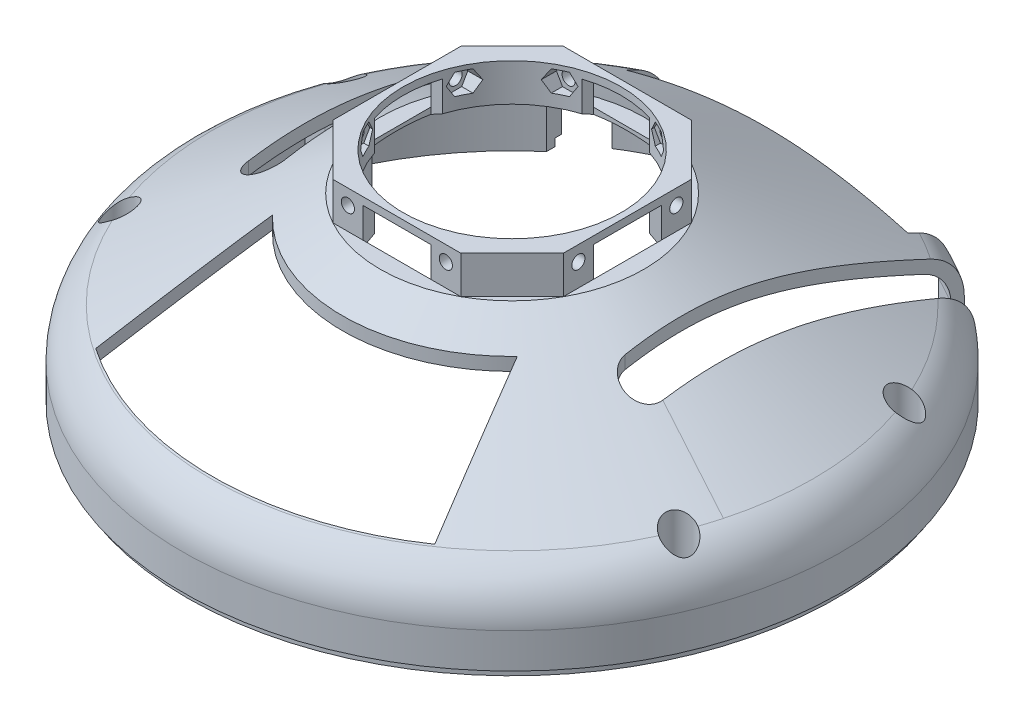
from build123d import *

# Parameters (mm, degrees)
SHELL2_T                                   = -3
SKETCH4_W                                  = 75
SKETCH4_H                                  = 40
CUT_EXTRUDE2_DEPTH                         = 134.463478216
SKETCH5_R                                  = 86
CUT_EXTRUDE3_DEPTH                         = 2
BOSS_EXTRUDE1_REACH                        = 135.463
SKETCH7_R                                  = 1.75
SKETCH8_R                                  = 4
CUT_EXTRUDE4_DEPTH                         = 43
MIRROR1_AT_THE_SECOND_PLANE_COPY_1_REACH   = 135.463
MIRROR1_AT_THE_SECOND_PLANE_COPY_1_SKETC_R = 1.75
MIRROR1_AT_THE_SECOND_PLANE_COPY_2_SKETC_R = 4
MIRROR1_AT_THE_SECOND_PLANE_COPY_2_DEPTH   = 43
CUT_EXTRUDE5_DEPTH                         = 134.463478319
CUT_EXTRUDE6_DEPTH                         = 134.463478319
SKETCH11_R                                 = 28.953306689
BOSS_EXTRUDE2_DEPTH                        = 10
SKETCH13_R                                 = 1.75
SKETCH13_W                                 = 18
SKETCH13_H                                 = 10
CUT_EXTRUDE7_DEPTH                         = 10
CUT_EXTRUDE8_DEPTH                         = 28
CIRPATTERN1_COUNT                          = 4
BOSS_EXTRUDE3_DEPTH                        = 2
CUT_EXTRUDE9_START                         = -2
CUT_EXTRUDE9_DEPTH                         = 2


with BuildPart() as part:
    # Sketch1 → Revolve1 (revolve)
    with BuildSketch(Plane.XY):
        with BuildLine():
            Line((0, 0), (-87.5, 0))
            Line((-87.5, 0), (-87.5, 11.295161968))
            ThreePointArc((-87.5, 11.295161968), (-85.473651397, 18.824064241), (-79.942084075, 24.3188091))
            Line((-79.942084075, 24.3188091), (-35, 50))
            Line((-35, 50), (0, 50))
            Line((0, 50), (0, 0))
        make_face()
    revolve(axis=Axis((0, 50, 0), (0, -1, 0)))

    # Shell2
    shell2_openings = [part.faces().sort_by_distance(p)[0] for p in [
        (0, 50, 0),
        (0, 0, 0),
    ]]
    offset(amount=SHELL2_T, openings=shell2_openings, kind=Kind.INTERSECTION)

    # Sketch4 → Cut-Extrude2 (cut, through all)
    with BuildSketch(Plane(origin=(0, 0, 0), x_dir=(1, 0, 0), z_dir=(0, 1, 0))):
        with Locations((0, 87.5)):
            Rectangle(SKETCH4_W, SKETCH4_H)
    extrude(amount=CUT_EXTRUDE2_DEPTH, mode=Mode.SUBTRACT)

    # Sketch5 → Cut-Extrude3 (cut)
    with BuildSketch(Plane.XZ):
        Circle(SKETCH5_R)
    extrude(amount=-CUT_EXTRUDE3_DEPTH, mode=Mode.SUBTRACT)

    # Sketch7 → Boss-Extrude1 (add, up to next)
    with BuildSketch(Plane.XZ, mode=Mode.PRIVATE) as boss_extrude1_sk1:
        with BuildLine():
            Line((-71.045427909, 33.86822026), (-75.679952978, 37.587161601))
            ThreePointArc((-75.679952978, 37.587161601), (-78.347035711, 31.654257144), (-80.549838693, 25.533771491))
            Line((-80.549838693, 25.533771491), (-74.632646623, 24.989542381))
            ThreePointArc((-74.632646623, 24.989542381), (-69.538789093, 28.095494506), (-71.045427909, 33.86822026))
        make_face()
        with Locations((-74.174708365, 29.968527473)):
            Circle(SKETCH7_R, mode=Mode.SUBTRACT)
    boss_extrude1_tool1 = extrude(boss_extrude1_sk1.sketch, amount=-BOSS_EXTRUDE1_REACH, mode=Mode.PRIVATE) - part.part
    boss_extrude1 = boss_extrude1_tool1.solids().sort_by_distance((-77.575683, 0, 25.430832))[0]
    add(boss_extrude1)

    # Sketch8 → Cut-Extrude4 (cut)
    with BuildSketch(Plane(origin=(0, 50, 0), x_dir=(1, 0, 0), z_dir=(0, 1, 0))):
        with Locations(Location((-74.174708365, -29.968527473, 0), (0, 0, 180))):
            Circle(SKETCH8_R)
    cut_extrude4 = extrude(amount=-CUT_EXTRUDE4_DEPTH, mode=Mode.SUBTRACT)

    # Mirror1: Boss-Extrude1, Cut-Extrude4 across plane
    add(boss_extrude1.mirror(Plane(origin=(0, 0, 0), x_dir=(0, 0, 1), z_dir=(1, 0, 0))))
    add(cut_extrude4.mirror(Plane(origin=(0, 0, 0), x_dir=(0, 0, 1), z_dir=(1, 0, 0))), mode=Mode.SUBTRACT)

    # Mirror1 at the second plane: Boss-Extrude1, Cut-Extrude4 across plane
    add(boss_extrude1.mirror(Plane.XY))
    add(cut_extrude4.mirror(Plane.XY), mode=Mode.SUBTRACT)

    # Mirror1 at the second plane copy 1 sketc → Mirror1 at the second plane copy 1 (add, up to next)
    with BuildSketch(Plane(origin=(0, 0, 0), x_dir=(-1, 0, 0), z_dir=(0, -1, 0)), mode=Mode.PRIVATE) as mirror1_at_the_second_plane_copy_1_sk1:
        with BuildLine():
            Line((-71.045427909, 33.86822026), (-75.679952978, 37.587161601))
            ThreePointArc((-75.679952978, 37.587161601), (-78.347035711, 31.654257144), (-80.549838693, 25.533771491))
            Line((-80.549838693, 25.533771491), (-74.632646623, 24.989542381))
            ThreePointArc((-74.632646623, 24.989542381), (-69.538789093, 28.095494506), (-71.045427909, 33.86822026))
        make_face()
        with Locations((-74.174708365, 29.968527473)):
            Circle(MIRROR1_AT_THE_SECOND_PLANE_COPY_1_SKETC_R, mode=Mode.SUBTRACT)
    mirror1_at_the_second_plane_copy_1_tool1 = extrude(mirror1_at_the_second_plane_copy_1_sk1.sketch, amount=-MIRROR1_AT_THE_SECOND_PLANE_COPY_1_REACH, mode=Mode.PRIVATE) - part.part
    add(mirror1_at_the_second_plane_copy_1_tool1.solids().sort_by_distance((77.575683, 0, -25.430832))[0])

    # Mirror1 at the second plane copy 2 sketc → Mirror1 at the second plane copy 2 (cut)
    with BuildSketch(Plane(origin=(0, 50, 0), x_dir=(-1, 0, 0), z_dir=(0, 1, 0))):
        with Locations(Location((-74.174708365, -29.968527473, 0), (0, 0, 180))):
            Circle(MIRROR1_AT_THE_SECOND_PLANE_COPY_2_SKETC_R)
    extrude(amount=-MIRROR1_AT_THE_SECOND_PLANE_COPY_2_DEPTH, mode=Mode.SUBTRACT)

    # Sketch9 → Cut-Extrude5 (cut, through all)
    with BuildSketch(Plane(origin=(0, 0, 0), x_dir=(1, 0, 0), z_dir=(0, 1, 0))):
        with BuildLine():
            Line((-45, 82.5), (-45, -15))
            ThreePointArc((-45, -15), (-50, -20), (-55, -15))
            Line((-55, -15), (-55, 82.5))
            ThreePointArc((-55, 82.5), (-50, 87.5), (-45, 82.5))
        make_face()
        with BuildLine():
            Line((45, -15), (45, 82.5))
            ThreePointArc((45, 82.5), (50, 87.5), (55, 82.5))
            Line((55, 82.5), (55, -15))
            ThreePointArc((55, -15), (50, -20), (45, -15))
        make_face()
    extrude(amount=CUT_EXTRUDE5_DEPTH, mode=Mode.SUBTRACT)

    # Sketch10 → Cut-Extrude6 (cut, through all)
    with BuildSketch(Plane(origin=(0, 0, 0), x_dir=(1, 0, 0), z_dir=(0, 1, 0))):
        with BuildLine():
            Line((-32.5, -31.124748995), (-45, -65.538156825))
            ThreePointArc((-45, -65.538156825), (0, -79.5), (45, -65.538156825))
            Line((45, -65.538156825), (32.5, -31.124748995))
            ThreePointArc((32.5, -31.124748995), (0, -45), (-32.5, -31.124748995))
        make_face()
    extrude(amount=CUT_EXTRUDE6_DEPTH, mode=Mode.SUBTRACT)

    # Sketch11 → Boss-Extrude2 (add)
    with BuildSketch(Plane(origin=(0, 50, 0), x_dir=(1, 0, 0), z_dir=(0, 1, 0))):
        Polygon((-17, 30.594117082), (-30.594117082, 17), (-30.594117082, -17), (-17, -30.594117082), (17, -30.594117082), (30.594117082, -17), (30.594117082, 17), (17, 30.594117082), align=None)
        with Locations(Location((0, 0, 0), (0, 0, 341.889818981))):
            Circle(SKETCH11_R, mode=Mode.SUBTRACT)
    extrude(amount=BOSS_EXTRUDE2_DEPTH)

    # Sketch13 → Cut-Extrude7 (cut)
    with BuildSketch(Plane.XY.offset(30.594117082)):
        with Locations((-13, 56)):
            Circle(SKETCH13_R)
        with Locations((13, 56)):
            Circle(SKETCH13_R)
        with Locations((0, 53)):
            Rectangle(SKETCH13_W, SKETCH13_H)
    cut_extrude7 = extrude(amount=-CUT_EXTRUDE7_DEPTH, mode=Mode.SUBTRACT)

    # Sketch14 → Cut-Extrude8 (cut)
    with BuildSketch(Plane.XY):
        Polygon((-9.766838493, 56), (-11.383419246, 58.8), (-14.616580754, 58.8), (-16.233161507, 56), (-14.616580754, 53.2), (-11.383419246, 53.2), align=None)
        Polygon((16.233161507, 56), (14.616580754, 58.8), (11.383419246, 58.8), (9.766838493, 56), (11.383419246, 53.2), (14.616580754, 53.2), align=None)
    cut_extrude8 = extrude(amount=CUT_EXTRUDE8_DEPTH, mode=Mode.SUBTRACT)

    # CirPattern1: Cut-Extrude7, Cut-Extrude8 ×4 about axis
    cirpattern1_axis = Axis((0, 0, 0), (0, 1, 0))
    add([cut_extrude7.rotate(cirpattern1_axis, i * 360 / CIRPATTERN1_COUNT) for i in range(1, CIRPATTERN1_COUNT)], mode=Mode.SUBTRACT)
    add([cut_extrude8.rotate(cirpattern1_axis, i * 360 / CIRPATTERN1_COUNT) for i in range(1, CIRPATTERN1_COUNT)], mode=Mode.SUBTRACT)

    # Sketch15 → Boss-Extrude3 (add)
    with BuildSketch(Plane.XZ.offset(-2)):
        with BuildLine():
            Line((-55, -66.113538704), (-55, -64.150214341))
            ThreePointArc((-55, -64.150214341), (-66.676168684, -51.908944602), (-75.679952978, -37.587161601))
            ThreePointArc((-75.679952978, -37.587161601), (-78.347035711, -31.654257144), (-80.549838693, -25.533771491))
            ThreePointArc((-80.549838693, -25.533771491), (-84.5, 0), (-80.549838693, 25.533771491))
            ThreePointArc((-80.549838693, 25.533771491), (-78.347035711, 31.654257144), (-75.679952978, 37.587161601))
            ThreePointArc((-75.679952978, 37.587161601), (0, 84.5), (75.679952978, 37.587161601))
            ThreePointArc((75.679952978, 37.587161601), (78.347035711, 31.654257144), (80.549838693, 25.533771491))
            ThreePointArc((80.549838693, 25.533771491), (84.5, 0), (80.549838693, -25.533771491))
            ThreePointArc((80.549838693, -25.533771491), (78.347035711, -31.654257144), (75.679952978, -37.587161601))
            ThreePointArc((75.679952978, -37.587161601), (66.676168684, -51.908944602), (55, -64.150214341))
            Line((55, -64.150214341), (55, -66.113538704))
            ThreePointArc((55, -66.113538704), (0, 86), (-55, -66.113538704))
        make_face()
        with BuildLine():
            Line((45, -73.287106642), (45, -71.520975944))
            ThreePointArc((45, -71.520975944), (41.303476002, -73.717520781), (37.5, -75.723180071))
            Line((37.5, -75.723180071), (37.5, -77.393475177))
            ThreePointArc((37.5, -77.393475177), (41.301066156, -75.433559735), (45, -73.287106642))
        make_face()
        with BuildLine():
            Line((-45, -71.520975944), (-45, -73.287106642))
            ThreePointArc((-45, -73.287106642), (-41.301066156, -75.433559735), (-37.5, -77.393475177))
            Line((-37.5, -77.393475177), (-37.5, -75.723180071))
            ThreePointArc((-37.5, -75.723180071), (-41.303476002, -73.717520781), (-45, -71.520975944))
        make_face()
    extrude(amount=BOSS_EXTRUDE3_DEPTH)

    # Sketch16 → Cut-Extrude9 (cut)
    with BuildSketch(Plane.XZ.offset(CUT_EXTRUDE9_START)):
        with BuildLine():
            Line((-55, -68.053287944), (-55, -66.373488683))
            ThreePointArc((-55, -66.373488683), (0, 86.2), (55, -66.373488683))
            Line((55, -66.373488683), (55, -68.053287944))
            ThreePointArc((55, -68.053287944), (0, 87.5), (-55, -68.053287944))
        make_face()
        with BuildLine():
            Line((45, -75.041655099), (45, -71.520975944))
            ThreePointArc((45, -71.520975944), (41.303476002, -73.717520781), (37.5, -75.723180071))
            Line((37.5, -75.723180071), (37.5, -79.056941504))
            ThreePointArc((37.5, -79.056941504), (41.298827238, -77.140500833), (45, -75.041655099))
        make_face()
        with BuildLine():
            Line((-37.5, -79.056941504), (-37.5, -75.723180071))
            ThreePointArc((-37.5, -75.723180071), (-41.303476002, -73.717520781), (-45, -71.520975944))
            Line((-45, -71.520975944), (-45, -75.041655099))
            ThreePointArc((-45, -75.041655099), (-41.298827238, -77.140500833), (-37.5, -79.056941504))
        make_face()
    extrude(amount=CUT_EXTRUDE9_DEPTH, mode=Mode.SUBTRACT)


solid = part.part
